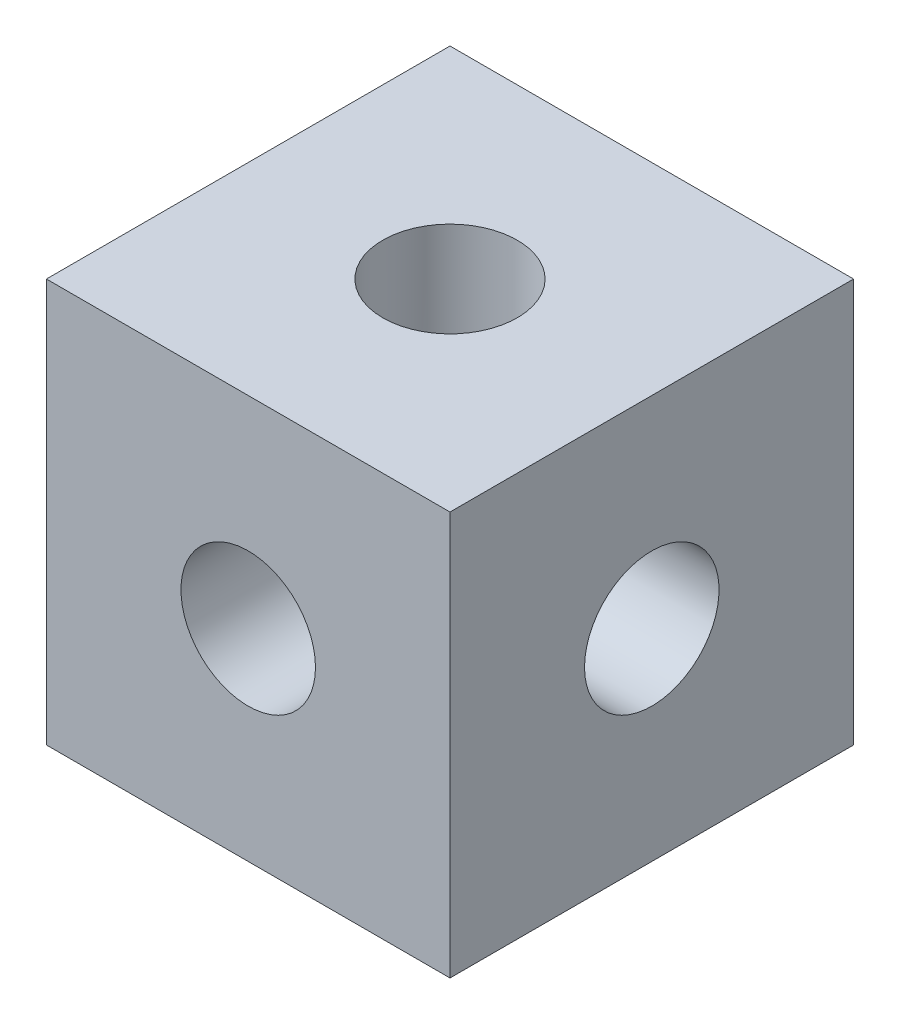
from build123d import *

# Parameters (mm, degrees)
SKETCH1_W           = 15
SKETCH1_H           = 15
BOSS_EXTRUDE1_DEPTH = 15
SKETCH3_R           = 2.5
CUT_EXTRUDE1_DEPTH  = 19.371173071
SKETCH4_R           = 2.5
CUT_EXTRUDE2_DEPTH  = 23.5
SKETCH5_R           = 2.5
CUT_EXTRUDE3_DEPTH  = 23.5


with BuildPart() as part:
    # Sketch1 → Boss-Extrude1 (new body)
    with BuildSketch(Plane(origin=(0, 0, 0), x_dir=(1, 0, 0), z_dir=(0, 1, 0))):
        Rectangle(SKETCH1_W, SKETCH1_H)
    extrude(amount=BOSS_EXTRUDE1_DEPTH)

    # Sketch3 → Cut-Extrude1 (cut, through all)
    with BuildSketch(Plane(origin=(0, 15, 0), x_dir=(1, 0, 0), z_dir=(0, 1, 0))):
        with Locations(Location((0, 0, 0), (0, 0, 270))):
            Circle(SKETCH3_R)
    extrude(amount=-CUT_EXTRUDE1_DEPTH, mode=Mode.SUBTRACT)

    # Sketch4 → Cut-Extrude2 (cut, through all)
    with BuildSketch(Plane.ZY.offset(7.5)):
        with Locations((0, 7.5)):
            Circle(SKETCH4_R)
    extrude(amount=-CUT_EXTRUDE2_DEPTH, mode=Mode.SUBTRACT)

    # Sketch5 → Cut-Extrude3 (cut, through all)
    with BuildSketch(Plane.XY.offset(7.5)):
        with Locations((0, 7.5)):
            Circle(SKETCH5_R)
    extrude(amount=-CUT_EXTRUDE3_DEPTH, mode=Mode.SUBTRACT)


solid = part.part
